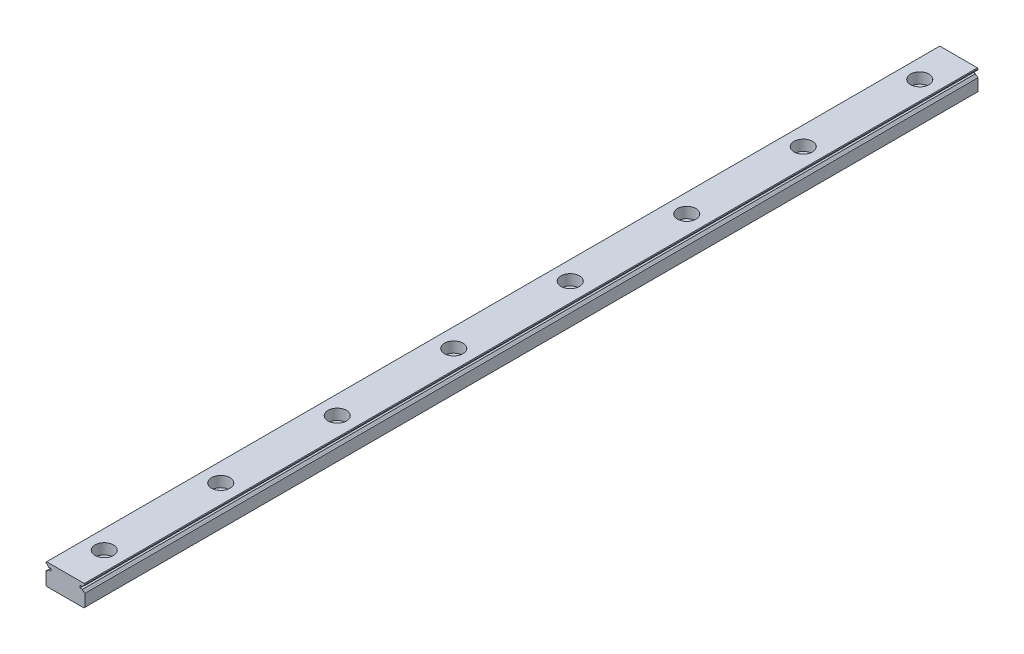
from build123d import *

# Parameters (mm, degrees)
BOSS_EXTRUDE1_DEPTH      = 230
BOSS_EXTRUDE1_DEPTH_BACK = 230


with BuildPart() as part:
    # Sketch1 → Boss-Extrude1 (new, two sides: drawn at the far end of the back side and taken through both)
    with BuildSketch(Plane.XY.offset(-BOSS_EXTRUDE1_DEPTH_BACK)):
        with BuildLine():
            Line((-10, 6.77615), (-10, 0.5))
            Line((-10, 0.5), (-9.5, 0))
            Line((-9.5, 0), (9.5, 0))
            Line((9.5, 0), (10, 0.5))
            Line((10, 0.5), (10, 6.77615))
            Line((10, 6.77615), (9.440021531, 7.099443113))
            ThreePointArc((9.440021531, 7.099443113), (9.015681976, 7.442706235), (8.71772889, 7.9))
            Line((8.71772889, 7.9), (7.5, 7.9))
            Line((7.5, 7.9), (7.5, 9.1))
            Line((7.5, 9.1), (8.71772889, 9.1))
            ThreePointArc((8.71772889, 9.1), (9.015681976, 9.557293765), (9.440021531, 9.900556887))
            Line((9.440021531, 9.900556887), (10, 10.22385))
            Line((10, 10.22385), (10, 10.7))
            Line((10, 10.7), (9.7, 11))
            Line((9.7, 11), (-9.7, 11))
            Line((-9.7, 11), (-10, 10.7))
            Line((-10, 10.7), (-10, 10.22385))
            Line((-10, 10.22385), (-9.440021531, 9.900556887))
            ThreePointArc((-9.440021531, 9.900556887), (-9.015681976, 9.557293765), (-8.71772889, 9.1))
            Line((-8.71772889, 9.1), (-7.5, 9.1))
            Line((-7.5, 9.1), (-7.5, 7.9))
            Line((-7.5, 7.9), (-8.71772889, 7.9))
            ThreePointArc((-8.71772889, 7.9), (-9.015681976, 7.442706235), (-9.440021531, 7.099443113))
            Line((-9.440021531, 7.099443113), (-10, 6.77615))
        make_face()
    extrude(amount=BOSS_EXTRUDE1_DEPTH + BOSS_EXTRUDE1_DEPTH_BACK)

    # Sketch2 → Cut-Revolve1 (revolve, cut)
    with BuildSketch(Plane(origin=(0, 0, 0), x_dir=(0, 0, -1), z_dir=(1, 0, 0))):
        Polygon((210, 11), (214.75, 11), (214.75, 5.5), (213, 5.5), (213, 0), (210, 0), align=None)
    revolve(axis=Axis((0, 0, -210), (0, 1, 0)), mode=Mode.SUBTRACT)

    # Sketch3 → Cut-Revolve2 (revolve, cut)
    with BuildSketch(Plane(origin=(0, 0, 0), x_dir=(0, 0, -1), z_dir=(1, 0, 0))):
        Polygon((150, 11), (154.75, 11), (154.75, 5.5), (153, 5.5), (153, 0), (150, 0), align=None)
    revolve(axis=Axis((0, 0, -150), (0, 1, 0)), mode=Mode.SUBTRACT)

    # Sketch4 → Cut-Revolve3 (revolve, cut)
    with BuildSketch(Plane(origin=(0, 0, 0), x_dir=(0, 0, -1), z_dir=(1, 0, 0))):
        Polygon((90, 11), (94.75, 11), (94.75, 5.5), (93, 5.5), (93, 0), (90, 0), align=None)
    revolve(axis=Axis((0, 0, -90), (0, 1, 0)), mode=Mode.SUBTRACT)

    # Sketch5 → Cut-Revolve4 (revolve, cut)
    with BuildSketch(Plane(origin=(0, 0, 0), x_dir=(0, 0, -1), z_dir=(1, 0, 0))):
        Polygon((30, 11), (34.75, 11), (34.75, 5.5), (33, 5.5), (33, 0), (30, 0), align=None)
    revolve(axis=Axis((0, 0, -30), (0, 1, 0)), mode=Mode.SUBTRACT)

    # Sketch6 → Cut-Revolve5 (revolve, cut)
    with BuildSketch(Plane(origin=(0, 0, 0), x_dir=(0, 0, -1), z_dir=(1, 0, 0))):
        Polygon((-30, 11), (-25.25, 11), (-25.25, 5.5), (-27, 5.5), (-27, 0), (-30, 0), align=None)
    revolve(axis=Axis((0, 0, 30), (0, 1, 0)), mode=Mode.SUBTRACT)

    # Sketch7 → Cut-Revolve6 (revolve, cut)
    with BuildSketch(Plane(origin=(0, 0, 0), x_dir=(0, 0, -1), z_dir=(1, 0, 0))):
        Polygon((-90, 11), (-85.25, 11), (-85.25, 5.5), (-87, 5.5), (-87, 0), (-90, 0), align=None)
    revolve(axis=Axis((0, 0, 90), (0, 1, 0)), mode=Mode.SUBTRACT)

    # Sketch8 → Cut-Revolve7 (revolve, cut)
    with BuildSketch(Plane(origin=(0, 0, 0), x_dir=(0, 0, -1), z_dir=(1, 0, 0))):
        Polygon((-150, 11), (-145.25, 11), (-145.25, 5.5), (-147, 5.5), (-147, 0), (-150, 0), align=None)
    revolve(axis=Axis((0, 0, 150), (0, 1, 0)), mode=Mode.SUBTRACT)

    # Sketch9 → Cut-Revolve8 (revolve, cut)
    with BuildSketch(Plane(origin=(0, 0, 0), x_dir=(0, 0, -1), z_dir=(1, 0, 0))):
        Polygon((-210, 11), (-205.25, 11), (-205.25, 5.5), (-207, 5.5), (-207, 0), (-210, 0), align=None)
    revolve(axis=Axis((0, 0, 210), (0, 1, 0)), mode=Mode.SUBTRACT)


solid = part.part
